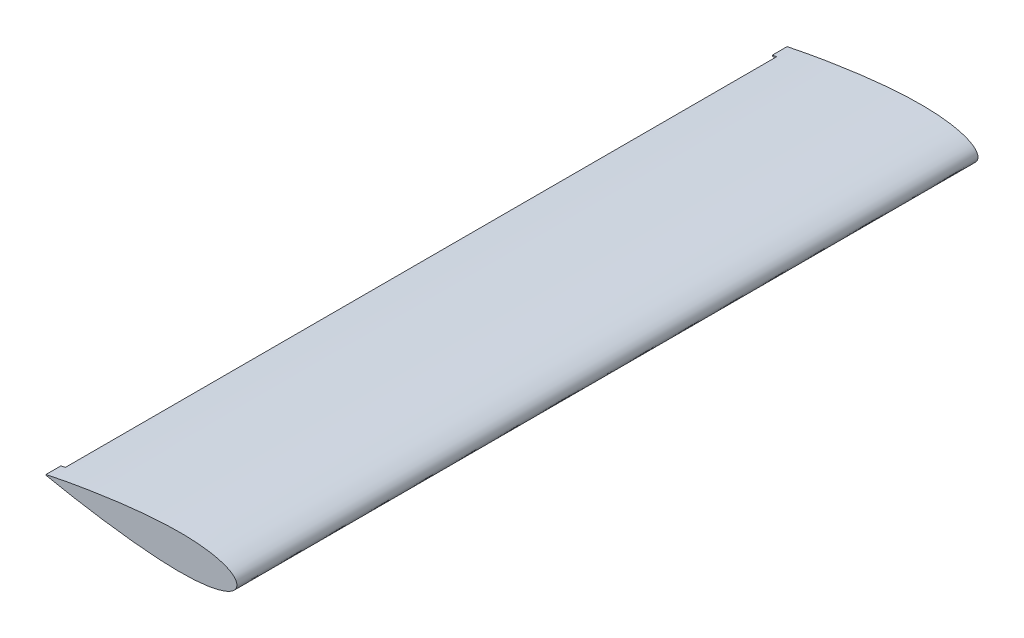
from build123d import *

# Parameters (mm, degrees)
SALIENTE_EXTRUIR1_DEPTH = 250
CORTAR_EXTRUIR1_DEPTH   = 240


with BuildPart() as part:
    # Croquis7 → Saliente-Extruir1 (new, symmetric)
    with BuildSketch(Plane.XY):
        with BuildLine():
            Line((-128.823156865, -0.243601684), (-128.823156865, 0.243601684))
            add(Edge.make_bspline(
                [(-128.823156865, 0.243601684), (-126.677149339, 0.68726909), (-122.389962266, 1.573605762), (-113.807735112, 3.21807022), (-103.079490165, 5.108627011), (-90.195489321, 7.121247156), (-77.313581576, 8.868867511), (-64.431363133, 10.297305917), (-51.546099741, 11.309820861), (-40.795756319, 11.66975117), (-32.200591208, 11.526230991), (-25.749007383, 11.144146261), (-19.285285965, 10.406614139), (-13.905555881, 9.375954963), (-9.614739884, 8.149997777), (-6.338179427, 6.911328297), (-3.593275067, 5.420388266), (-1.068996423, 3.357202526), (0.697558782, 1e-09), (-1.068996423, -3.357202524), (-3.593275067, -5.420388264), (-6.338179427, -6.911328295), (-9.614739884, -8.149997775), (-13.905555881, -9.375954962), (-19.285285965, -10.406614137), (-25.749007382, -11.144146259), (-32.200591208, -11.52623099), (-40.795756319, -11.669751169), (-51.546099741, -11.30982086), (-64.431363132, -10.297305916), (-77.313581576, -8.868867511), (-90.19548932, -7.121247156), (-103.079490165, -5.108627011), (-113.807735112, -3.21807022), (-122.389962266, -1.573605762), (-126.677149339, -0.68726909), (-128.823156865, -0.243601684)],
                knots=[0, 0, 0, 0, 0.024603893, 0.049152434, 0.098108557, 0.146905125, 0.195554767, 0.244056172, 0.292409414, 0.340643605, 0.364753981, 0.388905473, 0.413177962, 0.437756077, 0.450304615, 0.463229875, 0.477067414, 0.485035659, 0.5, 0.514964341, 0.522932586, 0.536770125, 0.549695385, 0.562243923, 0.586822038, 0.611094527, 0.635246019, 0.659356395, 0.707590586, 0.755943828, 0.804445233, 0.853094875, 0.901891443, 0.950847566, 0.975396107, 1, 1, 1, 1], degree=3))
        make_face()
    extrude(amount=SALIENTE_EXTRUIR1_DEPTH, both=True)

    # Croquis8 → Cortar-Extruir1 (cut, symmetric)
    with BuildSketch(Plane.XY):
        Polygon((-128.984178228, -0.617776664), (-128.984178228, 0.617776664), (-125.804711973, 1.25), (-125.804711973, -1.25), align=None)
    extrude(amount=CORTAR_EXTRUIR1_DEPTH, both=True, mode=Mode.SUBTRACT)


solid = part.part
